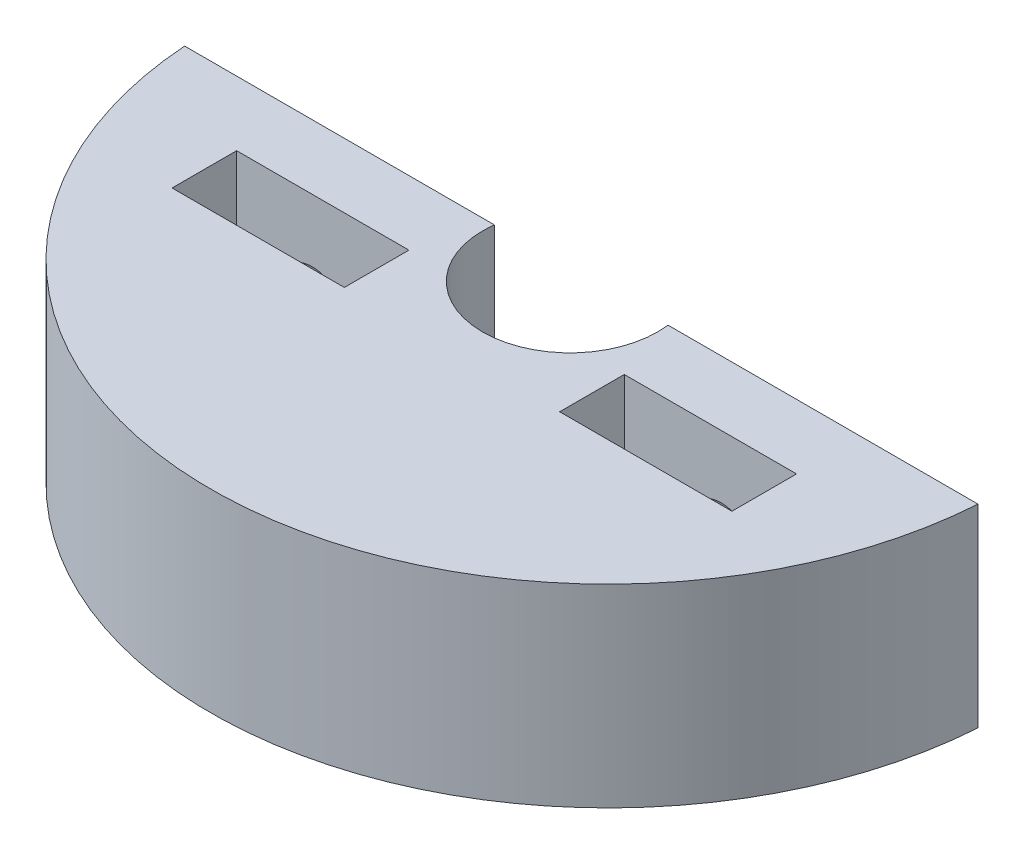
from build123d import *

# Parameters (mm, degrees)
BOSS_EXTRUDE1_DEPTH = 9
SKETCH2_R           = 1.585
CUT_EXTRUDE1_DEPTH  = 32
SKETCH3_W           = 8
SKETCH3_H           = 3
CUT_EXTRUDE4_DEPTH  = 32


with BuildPart() as part:
    # Sketch1 → Boss-Extrude1 (new body)
    with BuildSketch(Plane(origin=(0, 0, 0), x_dir=(1, 0, 0), z_dir=(0, 1, 0))):
        with BuildLine():
            Line((25.334549447, 26.26861883), (39.718507893, 26.26861883))
            ThreePointArc((39.718507893, 26.26861883), (43.74975272, 21.687555144), (47.780997547, 26.26861883))
            Line((47.780997547, 26.26861883), (62.176678451, 26.26861883))
            ThreePointArc((62.176678451, 26.26861883), (43.755613949, 9.05519235), (25.334549447, 26.26861883))
        make_face()
    extrude(amount=BOSS_EXTRUDE1_DEPTH)

    # Sketch2 → Cut-Extrude1 (cut)
    with BuildSketch(Plane(origin=(43.755613949, 0.001959277, -52.26861883), x_dir=(1, 0, 0), z_dir=(0, 0, 1))):
        with Locations((9.500000009, 4.5)):
            Circle(SKETCH2_R)
        with Locations((-9.499999996, 4.5)):
            Circle(SKETCH2_R)
    extrude(amount=CUT_EXTRUDE1_DEPTH, mode=Mode.SUBTRACT)

    # Sketch3 → Cut-Extrude4 (cut)
    with BuildSketch(Plane(origin=(0, 9, 0), x_dir=(1, 0, 0), z_dir=(0, 1, 0))):
        with Locations((52.74975272, 21.76861883)):
            Rectangle(SKETCH3_W, SKETCH3_H)
        with Locations((34.74975272, 21.76861883)):
            Rectangle(SKETCH3_W, SKETCH3_H)
    extrude(amount=-CUT_EXTRUDE4_DEPTH, mode=Mode.SUBTRACT)


solid = part.part
